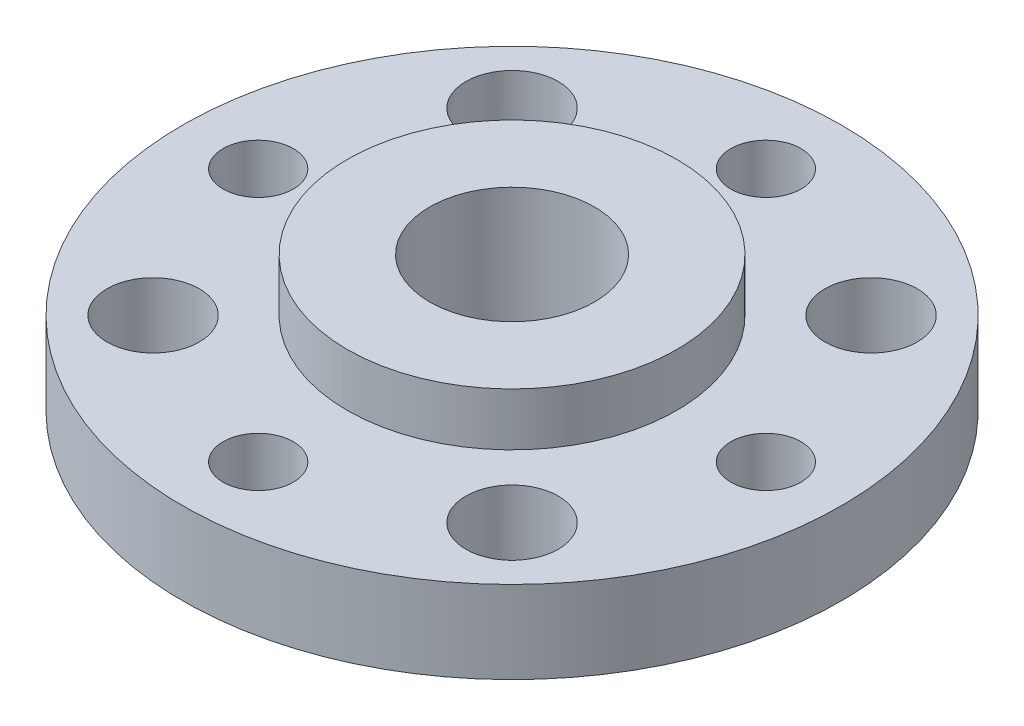
from build123d import *

# Parameters (mm, degrees)
SKETCH1_W                = 12.69619
SKETCH1_H                = 3.175
SKETCH2_R                = 6.34619
BOSS_EXTRUDE1_DEPTH      = 2.032
M2_5_CLEARANCE_HOLE1_D   = 2.7051
M3_CLEARANCE_HOLE1_D     = 3.556
M3_CLEARANCE_HOLE1_DEPTH = 5.207
SKETCH9_R                = 3.175
CUT_EXTRUDE1_DEPTH       = 19.694901177


with BuildPart() as part:
    # Sketch1 → Revolve1 (revolve)
    with BuildSketch(Plane.XY, mode=Mode.PRIVATE) as revolve1_sk:
        with Locations((6.348095, 1.5875)):
            Rectangle(SKETCH1_W, SKETCH1_H)
    revolve(revolve1_sk.sketch.rotate(Axis((0, 3.175, 0), (0, -1, 0)), 270), axis=Axis((0, 3.175, 0), (0, -1, 0)))

    # Sketch2 → Boss-Extrude1 (add)
    with BuildSketch(Plane(origin=(0, 3.175, 0), x_dir=(-1, 0, 0), z_dir=(0, 1, 0))):
        with Locations(Location((0, 0, 0), (0, 0, 90))):
            Circle(SKETCH2_R)
    extrude(amount=BOSS_EXTRUDE1_DEPTH)

    # M2.5 Clearance Hole1 (through all)
    with Locations(Plane(origin=(0, 3.175, 0), x_dir=(1, 0, 0), z_dir=(0, 1, 0))):
        with Locations((-9.779, 0), (0, 9.779), (9.779, 0), (0, -9.779)):
            Hole(M2_5_CLEARANCE_HOLE1_D / 2)

    # M3 Clearance Hole1
    with Locations(Plane(origin=(0, 0, 0), x_dir=(-1, 0, 0), z_dir=(0, -1, 0))):
        with Locations((6.914797213, 6.914797213), (-6.914797213, 6.914797213), (-6.914797213, -6.914797213), (6.914797213, -6.914797213)):
            Hole(M3_CLEARANCE_HOLE1_D / 2, depth=M3_CLEARANCE_HOLE1_DEPTH)

    # Sketch9 → Cut-Extrude1 (cut, through all)
    with BuildSketch(Plane(origin=(0, 5.207, 0), x_dir=(1, 0, 0), z_dir=(0, 1, 0))):
        with Locations(Location((0, 0, 0), (0, 0, 270))):
            Circle(SKETCH9_R)
    extrude(amount=-CUT_EXTRUDE1_DEPTH, mode=Mode.SUBTRACT)


solid = part.part
